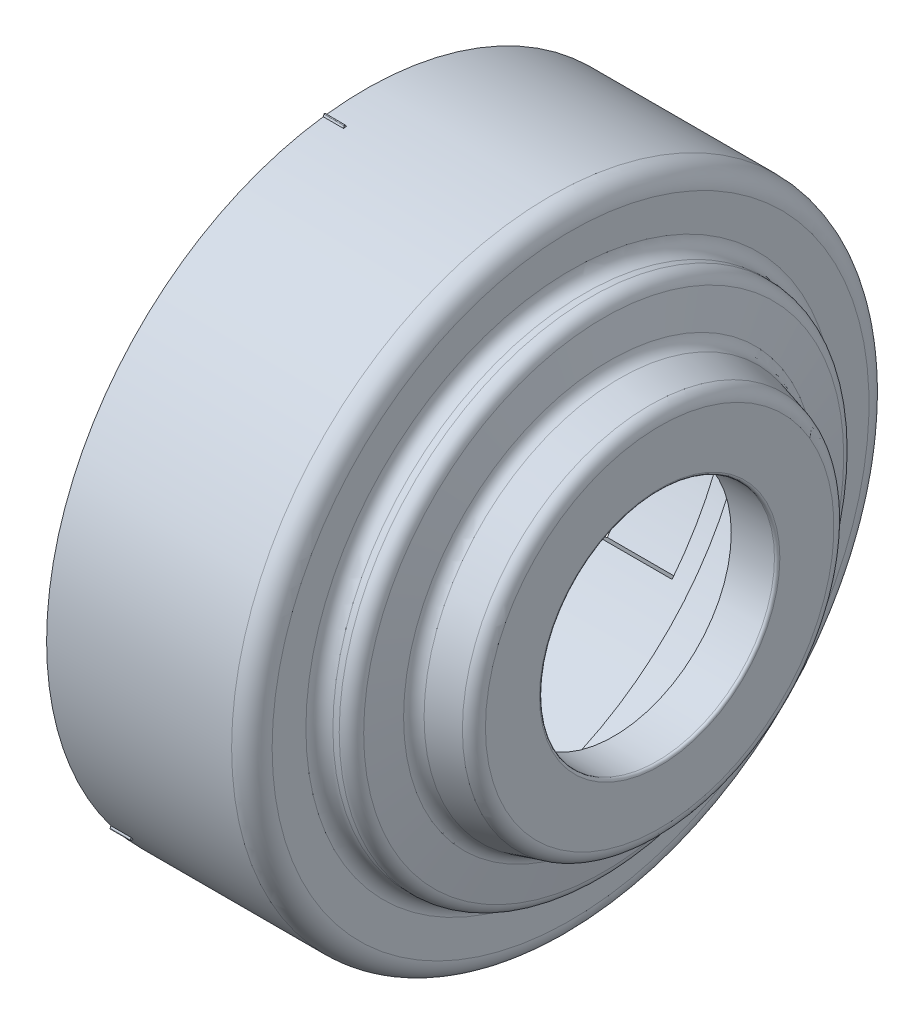
from build123d import *

# Parameters (mm, degrees)
FILLET_1_R               = 0.2
FILLET_2_R               = 1
FILLET_3_R               = 1.5
CUT_EXTRUDE_START        = -1
CUT_EXTRUDE_1_DEPTH      = 1
CUT_EXTRUDE_START_2      = -5.5
CUT_EXTRUDE_2_DEPTH      = 5.5
SKETCH_5_W               = 2.200000000000001
SKETCH_5_H               = 1.458146796235166
CUT_REVOLVE_1_ANGLE      = 24.000000000000053
CUT_EXTRUDE_3_REACH      = 51.835
CUT_EXTRUDE_3_END_RADIUS = 22.8
PATTERN_CIRCULAR_1_COUNT = 3
CUT_EXTRUDE_5_REACH      = 40.16
PATTERN_CIRCULAR_3_COUNT = 3
CUT_EXTRUDE_6_REACH      = 40.16
CUT_EXTRUDE_7_REACH      = 40.16
EXTRUDE_2_DEPTH          = 1.5
PATTERN_CIRCULAR_7_COUNT = 3


with BuildPart() as part:
    # 草图2 → 旋转1 (revolve)
    with BuildSketch(Plane.XY, mode=Mode.PRIVATE) as revolve_1_sk:
        Polygon((-13.999999999999998, 22), (-6.899999999999999, 22), (-6.899999999999999, 21.599999999999998), (1.73e-15, 21.599999999999998), (2.28e-15, 17.4), (2.500000000000002, 17.4), (3.157262574057294, 13.672478713033763), (6.600000000000001, 12.75), (6.600000000000003, 9.4), (4.400000000000003, 9.4), (4.400000000000003, 8.700000000000001), (7.800000000000003, 8.700000000000001), (7.800000000000003, 13.670792385574746), (4.206280569869923, 14.633726604702153), (3.506919557412737, 18.599999999999998), (1.200000000000002, 18.599999999999998), (1.2000000000000015, 23.599999999999998), (-13.999999999999998, 23.599999999999998), align=None)
    revolve(revolve_1_sk.sketch.rotate(Axis((-36.93660531697341, 0, 0), (1, 0, 0)), 90), axis=Axis((-36.93660531697341, 0, 0), (1, 0, 0)))

    # 圆角1
    fillet_1_edges = [part.edges().sort_by_distance(p)[0] for p in [
        (0, 4.55e-15, -21.599999999999998),
        (0, -4.06e-15, -17.4),
        (2.5, -4.06e-15, -17.4),
        (6.600000000000001, -2.98e-15, -12.75),
        (7.800000000000004, -2.03e-15, -8.700000000000001),
    ]]
    fillet(fillet_1_edges, radius=FILLET_1_R)

    # 圆角2
    fillet_2_edges = [part.edges().sort_by_distance(p)[0] for p in [
        (7.800000000000004, -3.19e-15, -13.670792385574746),
        (4.206280569869925, -3.42e-15, -14.633726604702153),
        (3.5069195574127363, -4.34e-15, -18.599999999999998),
        (1.2000000000000028, -4.34e-15, -18.599999999999998),
    ]]
    fillet(fillet_2_edges, radius=FILLET_2_R)

    # 圆角3
    fillet_3_edges = [part.edges().sort_by_distance(p)[0] for p in [
        (3.1572625740572917, -3.19e-15, -13.672478713033763),
        (1.2000000000000028, -5.51e-15, -23.599999999999998),
    ]]
    fillet(fillet_3_edges, radius=FILLET_3_R)

    # 草图3 → 切除-拉伸1 (cut)
    with BuildSketch(Plane.ZY.offset(13.999999999999998).offset(CUT_EXTRUDE_START)):
        with BuildLine():
            Line((-0.49999999999999933, 22.599999999999998), (0.5000000000000004, 22.599999999999998))
            Line((0.5000000000000004, 22.599999999999998), (0.5000000000000006, 21.99431744792277))
            ThreePointArc((0.5000000000000006, 21.99431744792277), (1.35e-15, 22), (-0.4999999999999993, 21.99431744792277))
            Line((-0.4999999999999993, 21.99431744792277), (-0.49999999999999933, 22.599999999999998))
        make_face()
    extrude(amount=CUT_EXTRUDE_1_DEPTH, mode=Mode.SUBTRACT)

    # 草图4 → 切除-拉伸2 (cut)
    with BuildSketch(Plane.ZY.offset(13.999999999999998).offset(CUT_EXTRUDE_START_2)):
        with BuildLine():
            Line((-3.2499999999999982, 22.56717749298747), (-3.2499999999999987, 21.75861898191151))
            ThreePointArc((-3.2499999999999987, 21.75861898191151), (1.35e-15, 21.999999999999996), (3.2500000000000013, 21.75861898191151))
            Line((3.2500000000000013, 21.75861898191151), (3.2500000000000018, 22.567177492987465))
            ThreePointArc((3.2500000000000018, 22.567177492987465), (1.4e-15, 22.8), (-3.2499999999999982, 22.56717749298747))
        make_face()
    cut_extrude_2 = extrude(amount=CUT_EXTRUDE_2_DEPTH, mode=Mode.SUBTRACT)

    # 草图5 → 切除-旋转1 (revolve, cut)
    with BuildSketch(Plane.XY):
        with Locations((-9.599999999999994, 22.070926601882412)):
            Rectangle(SKETCH_5_W, SKETCH_5_H)
    cut_revolve_1 = revolve(axis=Axis((16.624194515447005, 0, 0), (1, 0, 0)), revolution_arc=CUT_REVOLVE_1_ANGLE, mode=Mode.SUBTRACT)

    # 切除-拉伸3: up to this cylinder (the profile starts inside it)
    cut_extrude_3_end = Plane(origin=(-10.733154, 0, 0), z_dir=(-1, 0, 0)) * Cylinder(CUT_EXTRUDE_3_END_RADIUS, 150.27, mode=Mode.PRIVATE)
    # 草图6 → 切除-拉伸3 (cut, up to the surface)
    with BuildSketch(Plane(origin=(0, 18, 0), x_dir=(1, 0, 0), z_dir=(0, 1, 0)), mode=Mode.PRIVATE) as cut_extrude_3_sk1:
        Polygon((-10.699999999999994, -8.948206147667621), (-10.699999999999994, -3.2500000000000013), (-10.799462558281862, -8.948206147667621), align=None)
    cut_extrude_3_tool1 = extrude(cut_extrude_3_sk1.sketch, amount=CUT_EXTRUDE_3_REACH, mode=Mode.PRIVATE) & cut_extrude_3_end
    cut_extrude_3 = cut_extrude_3_tool1.solids().sort_by_distance((-10.733154, 18, 7.048804))[0]
    add(cut_extrude_3, mode=Mode.SUBTRACT)

    # 阵列(圆周)1: 切除-拉伸2, 切除-旋转1 ×3 about axis
    pattern_circular_1_axis = Axis((0, 5e-17, 2e-16), (1, 0, 0))
    add([cut_extrude_2.rotate(pattern_circular_1_axis, i * 360 / PATTERN_CIRCULAR_1_COUNT) for i in range(1, PATTERN_CIRCULAR_1_COUNT)], mode=Mode.SUBTRACT)
    add([cut_revolve_1.rotate(pattern_circular_1_axis, i * 360 / PATTERN_CIRCULAR_1_COUNT) for i in range(1, PATTERN_CIRCULAR_1_COUNT)], mode=Mode.SUBTRACT)

    # 切除-拉伸5: up to this face of the body (flat: up to its plane)
    cut_extrude_5_end = Plane(part.part.faces().sort_by_distance((-10.750360581, 21.4748312, 6.135155752))[0])
    # 草图9 → 切除-拉伸5 (cut, up to the picked face)
    with BuildSketch(Plane(origin=(-10.699999999999994, 0, 0), x_dir=(0, 0, -1), z_dir=(1, 0, 0)), mode=Mode.PRIVATE) as cut_extrude_5_sk1:
        with BuildLine():
            Line((-9.273595462128261, 20.82883643425129), (-8.948206147667621, 20.09800006813721))
            Line((-8.948206147667621, 20.09800006813721), (-8.948206147667618, 20.970684460428163))
            ThreePointArc((-8.948206147667618, 20.970684460428163), (-9.111176855506788, 20.90039368786333), (-9.273595462128261, 20.82883643425129))
        make_face()
    cut_extrude_5_tool1 = split(extrude(cut_extrude_5_sk1.sketch, amount=-CUT_EXTRUDE_5_REACH, mode=Mode.PRIVATE), bisect_by=cut_extrude_5_end, keep=Keep.BOTH, mode=Mode.PRIVATE)
    add(cut_extrude_5_tool1.solids().sort_by(Axis((-10.7, 20.632815, 9.056732), (-1, 0, 0)))[0], mode=Mode.SUBTRACT)

    # 阵列(圆周)3: 切除-拉伸3 ×3 about axis
    pattern_circular_3_axis = Axis((0, 0, 3e-17), (1, 0, 0))
    for i in range(1, PATTERN_CIRCULAR_3_COUNT):
        add(cut_extrude_3.rotate(pattern_circular_3_axis, i * 360 / PATTERN_CIRCULAR_3_COUNT), mode=Mode.SUBTRACT)

    # 切除-拉伸6: up to this face of the body (flat: up to its plane)
    cut_extrude_6_end = Plane(part.part.faces().sort_by_distance((-10.750360581, -5.424214863, -21.665327237))[0])
    # 草图10 → 切除-拉伸6 (cut, up to the picked face)
    with BuildSketch(Plane(origin=(-10.699999999999994, 0, 0), x_dir=(0, 0, -1), z_dir=(1, 0, 0)), mode=Mode.PRIVATE) as cut_extrude_6_sk1:
        with BuildLine():
            Line((22.675099214396656, -2.383248962502268), (21.879481698102033, -2.2996261918881546))
            Line((21.879481698102033, -2.2996261918881546), (22.63524855131219, -2.7359683880336263))
            ThreePointArc((22.63524855131219, -2.7359683880336263), (22.655860310538994, -2.5596862286897593), (22.675099214396656, -2.383248962502268))
        make_face()
    cut_extrude_6_tool1 = split(extrude(cut_extrude_6_sk1.sketch, amount=-CUT_EXTRUDE_6_REACH, mode=Mode.PRIVATE), bisect_by=cut_extrude_6_end, keep=Keep.BOTH, mode=Mode.PRIVATE)
    add(cut_extrude_6_tool1.solids().sort_by(Axis((-10.7, -2.473048, -22.396907), (-1, 0, 0)))[0], mode=Mode.SUBTRACT)

    # 切除-拉伸7: up to this face of the body (flat: up to its plane)
    cut_extrude_7_end = Plane(part.part.faces().sort_by_distance((-10.750360581, -16.050616337, 15.530171486))[0])
    # 草图11 → 切除-拉伸7 (cut, up to the picked face)
    with BuildSketch(Plane(origin=(-10.699999999999994, 0, 0), x_dir=(0, 0, -1), z_dir=(1, 0, 0)), mode=Mode.PRIVATE) as cut_extrude_7_sk1:
        with BuildLine():
            Line((-13.401503752268288, -18.445587471748876), (-12.93127555043432, -17.79837387624892))
            Line((-12.93127555043432, -17.79837387624892), (-13.687042403644462, -18.234716072394395))
            ThreePointArc((-13.687042403644462, -18.234716072394395), (-13.5446834550321, -18.340707459173426), (-13.401503752268288, -18.445587471748876))
        make_face()
    cut_extrude_7_tool1 = split(extrude(cut_extrude_7_sk1.sketch, amount=-CUT_EXTRUDE_7_REACH, mode=Mode.PRIVATE), bisect_by=cut_extrude_7_end, keep=Keep.BOTH, mode=Mode.PRIVATE)
    add(cut_extrude_7_tool1.solids().sort_by(Axis((-10.7, -18.159767, 13.340176), (-1, 0, 0)))[0], mode=Mode.SUBTRACT)

    # 草图14 → 凸台-拉伸2 (add)
    with BuildSketch(Plane.ZY.offset(13.999999999999998)):
        with BuildLine():
            Line((2.8852684537650393, 23.422963645741078), (2.9729398410513204, 23.538035786817254))
            ThreePointArc((2.9729398410513204, 23.538035786817254), (3.0190677966101642, 23.55732857603917), (3.0588398199656246, 23.527026989311526))
            Line((3.0588398199656246, 23.527026989311526), (3.1146595237623087, 23.39356527019848))
            ThreePointArc((3.1146595237623087, 23.39356527019848), (2.999999999999998, 23.40854544819049), (2.8852684537650393, 23.422963645741078))
        make_face()
    extrude_2 = extrude(amount=-EXTRUDE_2_DEPTH)

    # 阵列(圆周)7: 凸台-拉伸2 ×3 about axis
    pattern_circular_7_axis = Axis((0, -4.9e-16, -4.4e-16), (1, 0, 0))
    for i in range(1, PATTERN_CIRCULAR_7_COUNT):
        add(extrude_2.rotate(pattern_circular_7_axis, i * 360 / PATTERN_CIRCULAR_7_COUNT))


solid = part.part
